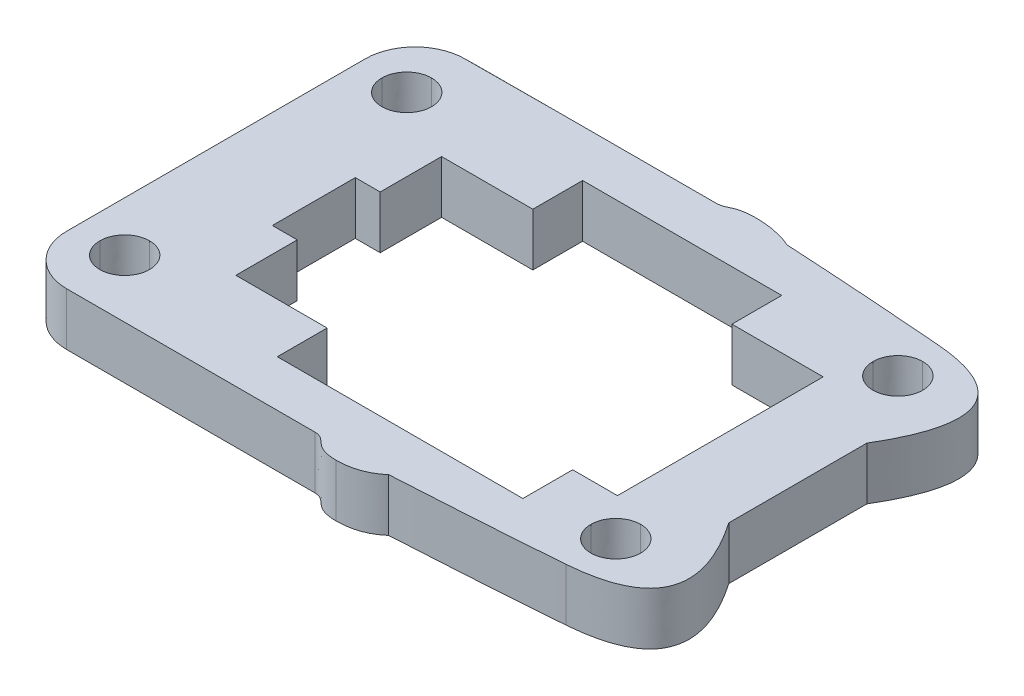
from build123d import *

# Parameters (mm, degrees)
BOSS_EXTRUDE1_DEPTH = 3.175


with BuildPart() as part:
    # Sketch1 → Boss-Extrude1 (new body)
    with BuildSketch(Plane(origin=(0, 0, 0), x_dir=(1, 0, 0), z_dir=(0, 1, 0))):
        with BuildLine():
            Line((111.509960584, 9.630537226), (111.509960584, 27.630337226))
            add(Edge.make_bspline(
                [(111.509960584, 27.630337226), (111.509960584, 28.425937226), (111.826160584, 29.189037226), (112.388760584, 29.751637226)],
                knots=[0.058823529, 0.058823529, 0.058823529, 0.058823529, 0.117647059, 0.117647059, 0.117647059, 0.117647059], degree=3))
            add(Edge.make_bspline(
                [(112.388760584, 29.751637226), (112.951360584, 30.314237226), (113.714360584, 30.630337226), (114.509960584, 30.630337226)],
                knots=[0.117647059, 0.117647059, 0.117647059, 0.117647059, 0.176470588, 0.176470588, 0.176470588, 0.176470588], degree=3))
            add(Edge.make_bspline(
                [(114.509960584, 30.630337226), (114.497160584, 30.650837226), (123.834160584, 30.675137226), (129.557760584, 30.665837226)],
                knots=[0.176470588, 0.176470588, 0.176470588, 0.176470588, 0.235294118, 0.235294118, 0.235294118, 0.235294118], degree=3))
            add(Edge.make_bspline(
                [(129.557760584, 30.665837226), (130.304960584, 30.664637226), (130.243960584, 31.102237226), (131.588760584, 31.102237226)],
                knots=[0.235294118, 0.235294118, 0.235294118, 0.235294118, 0.294117647, 0.294117647, 0.294117647, 0.294117647], degree=3))
            add(Edge.make_bspline(
                [(131.588760584, 31.102237226), (133.000560584, 31.102237226), (133.900960584, 30.644837226), (133.909960584, 30.630337226)],
                knots=[0.294117647, 0.294117647, 0.294117647, 0.294117647, 0.352941176, 0.352941176, 0.352941176, 0.352941176], degree=3))
            add(Edge.make_bspline(
                [(133.909960584, 30.630337226), (138.951860584, 30.347537226), (143.675260584, 29.965237226)],
                knots=[0.352941176, 0.352941176, 0.352941176, 0.411764706, 0.411764706, 0.411764706], degree=2))
            add(Edge.make_bspline(
                [(143.675260584, 29.965237226), (150.711460584, 29.395637226), (146.684560584, 22.686437226)],
                knots=[0.411764706, 0.411764706, 0.411764706, 0.470588235, 0.470588235, 0.470588235], degree=2))
            Line((146.684560584, 22.686437226), (146.684560584, 14.367137226))
            add(Edge.make_bspline(
                [(146.684560584, 14.367137226), (151.159460584, 7.865237226), (143.935660584, 7.295637226)],
                knots=[0.529411765, 0.529411765, 0.529411765, 0.588235294, 0.588235294, 0.588235294], degree=2))
            add(Edge.make_bspline(
                [(143.935660584, 7.295637226), (139.086260584, 6.913337226), (133.909960584, 6.630537226)],
                knots=[0.588235294, 0.588235294, 0.588235294, 0.647058824, 0.647058824, 0.647058824], degree=2))
            add(Edge.make_bspline(
                [(133.909960584, 6.630537226), (132.982260584, 5.801937226), (131.588760584, 5.801937226)],
                knots=[0.647058824, 0.647058824, 0.647058824, 0.705882353, 0.705882353, 0.705882353], degree=2))
            add(Edge.make_bspline(
                [(131.588760584, 5.801937226), (130.078160584, 5.801937226), (130.269860584, 6.630537226), (129.469560584, 6.630537226)],
                knots=[0.705882353, 0.705882353, 0.705882353, 0.705882353, 0.764705882, 0.764705882, 0.764705882, 0.764705882], degree=3))
            add(Edge.make_bspline(
                [(129.469560584, 6.630537226), (123.742760584, 6.630537226), (114.509960584, 6.630537226)],
                knots=[0.764705882, 0.764705882, 0.764705882, 0.823529412, 0.823529412, 0.823529412], degree=2))
            add(Edge.make_bspline(
                [(114.509960584, 6.630537226), (113.714360584, 6.630537226), (112.951360584, 6.946537226), (112.388760584, 7.509137226)],
                knots=[0.823529412, 0.823529412, 0.823529412, 0.823529412, 0.882352941, 0.882352941, 0.882352941, 0.882352941], degree=3))
            add(Edge.make_bspline(
                [(112.388760584, 7.509137226), (111.826160584, 8.071737226), (111.509960584, 8.834837226), (111.509960584, 9.630537226)],
                knots=[0.882352941, 0.882352941, 0.882352941, 0.882352941, 1, 1, 1, 1], degree=3))
        make_face()
        Polygon((117.410060584, 16.130337226), (118.909960584, 16.130337226), (118.909960584, 12.430337226), (124.409960584, 12.430337226), (124.409960584, 9.430537226), (139.209960584, 9.430537226), (139.209960584, 12.430337226), (141.909960584, 12.430337226), (141.909960584, 24.830337226), (136.409960584, 24.830337226), (136.409960584, 27.830337226), (124.409960584, 27.830337226), (124.409960584, 24.830337226), (118.909960584, 24.830337226), (118.909960584, 21.130337226), (117.410060584, 21.130337226), align=None, mode=Mode.SUBTRACT)
        with BuildLine():
            add(Edge.make_bspline(
                [(116.009960584, 27.130337226), (116.009960584, 26.301837226), (115.338460584, 25.630337226), (114.510060584, 25.630337226)],
                knots=[0, 0, 0, 0, 0.2, 0.2, 0.2, 0.2], degree=3))
            add(Edge.make_bspline(
                [(114.510060584, 25.630337226), (113.681560584, 25.630237226), (113.010060584, 26.301837226), (113.010060584, 27.130237226)],
                knots=[0.2, 0.2, 0.2, 0.2, 0.4, 0.4, 0.4, 0.4], degree=3))
            add(Edge.make_bspline(
                [(113.010060584, 27.130237226), (113.009960584, 27.958737226), (113.681560584, 28.630237226), (114.509960584, 28.630337226)],
                knots=[0.4, 0.4, 0.4, 0.4, 0.6, 0.6, 0.6, 0.6], degree=3))
            add(Edge.make_bspline(
                [(114.509960584, 28.630337226), (115.338460584, 28.630337226), (116.009960584, 27.958737226), (116.009960584, 27.130337226)],
                knots=[0.6, 0.6, 0.6, 0.6, 1, 1, 1, 1], degree=3))
        make_face(mode=Mode.SUBTRACT)
        with BuildLine():
            add(Edge.make_bspline(
                [(145.609960584, 10.130537226), (145.609960584, 9.302137226), (144.938360584, 8.630537226), (144.110060584, 8.630537226)],
                knots=[0, 0, 0, 0, 0.2, 0.2, 0.2, 0.2], degree=3))
            add(Edge.make_bspline(
                [(144.110060584, 8.630537226), (143.281660584, 8.630537226), (142.610060584, 9.302137226), (142.610060584, 10.130437226)],
                knots=[0.2, 0.2, 0.2, 0.2, 0.4, 0.4, 0.4, 0.4], degree=3))
            add(Edge.make_bspline(
                [(142.610060584, 10.130437226), (142.610060584, 10.958837226), (143.281660584, 11.630237226), (144.109960584, 11.630237226)],
                knots=[0.4, 0.4, 0.4, 0.4, 0.6, 0.6, 0.6, 0.6], degree=3))
            add(Edge.make_bspline(
                [(144.109960584, 11.630237226), (144.938360584, 11.630237226), (145.609960584, 10.958837226), (145.609960584, 10.130537226)],
                knots=[0.6, 0.6, 0.6, 0.6, 1, 1, 1, 1], degree=3))
        make_face(mode=Mode.SUBTRACT)
        with BuildLine():
            add(Edge.make_bspline(
                [(116.009960584, 10.130537226), (116.009960584, 9.302137226), (115.338360584, 8.630437226), (114.510060584, 8.630437226)],
                knots=[0, 0, 0, 0, 0.2, 0.2, 0.2, 0.2], degree=3))
            add(Edge.make_bspline(
                [(114.510060584, 8.630437226), (113.681660584, 8.630437226), (113.009960584, 9.302137226), (113.009960584, 10.130437226)],
                knots=[0.2, 0.2, 0.2, 0.2, 0.4, 0.4, 0.4, 0.4], degree=3))
            add(Edge.make_bspline(
                [(113.009960584, 10.130437226), (113.009960584, 10.958837226), (113.681660584, 11.630337226), (114.509960584, 11.630337226)],
                knots=[0.4, 0.4, 0.4, 0.4, 0.6, 0.6, 0.6, 0.6], degree=3))
            add(Edge.make_bspline(
                [(114.509960584, 11.630337226), (115.338360584, 11.630337226), (116.009960584, 10.958837226), (116.009960584, 10.130537226)],
                knots=[0.6, 0.6, 0.6, 0.6, 1, 1, 1, 1], degree=3))
        make_face(mode=Mode.SUBTRACT)
        with BuildLine():
            add(Edge.make_bspline(
                [(145.609960584, 27.130337226), (145.609960584, 26.301837226), (144.938460584, 25.630437226), (144.110060584, 25.630437226)],
                knots=[0, 0, 0, 0, 0.2, 0.2, 0.2, 0.2], degree=3))
            add(Edge.make_bspline(
                [(144.110060584, 25.630437226), (143.281560584, 25.630337226), (142.610160584, 26.301837226), (142.610160584, 27.130237226)],
                knots=[0.2, 0.2, 0.2, 0.2, 0.4, 0.4, 0.4, 0.4], degree=3))
            add(Edge.make_bspline(
                [(142.610160584, 27.130237226), (142.610060584, 27.958737226), (143.281560584, 28.630137226), (144.109960584, 28.630237226)],
                knots=[0.4, 0.4, 0.4, 0.4, 0.6, 0.6, 0.6, 0.6], degree=3))
            add(Edge.make_bspline(
                [(144.109960584, 28.630237226), (144.938460584, 28.630237226), (145.609960584, 27.958737226), (145.609960584, 27.130337226)],
                knots=[0.6, 0.6, 0.6, 0.6, 1, 1, 1, 1], degree=3))
        make_face(mode=Mode.SUBTRACT)
    extrude(amount=BOSS_EXTRUDE1_DEPTH)


solid = part.part
